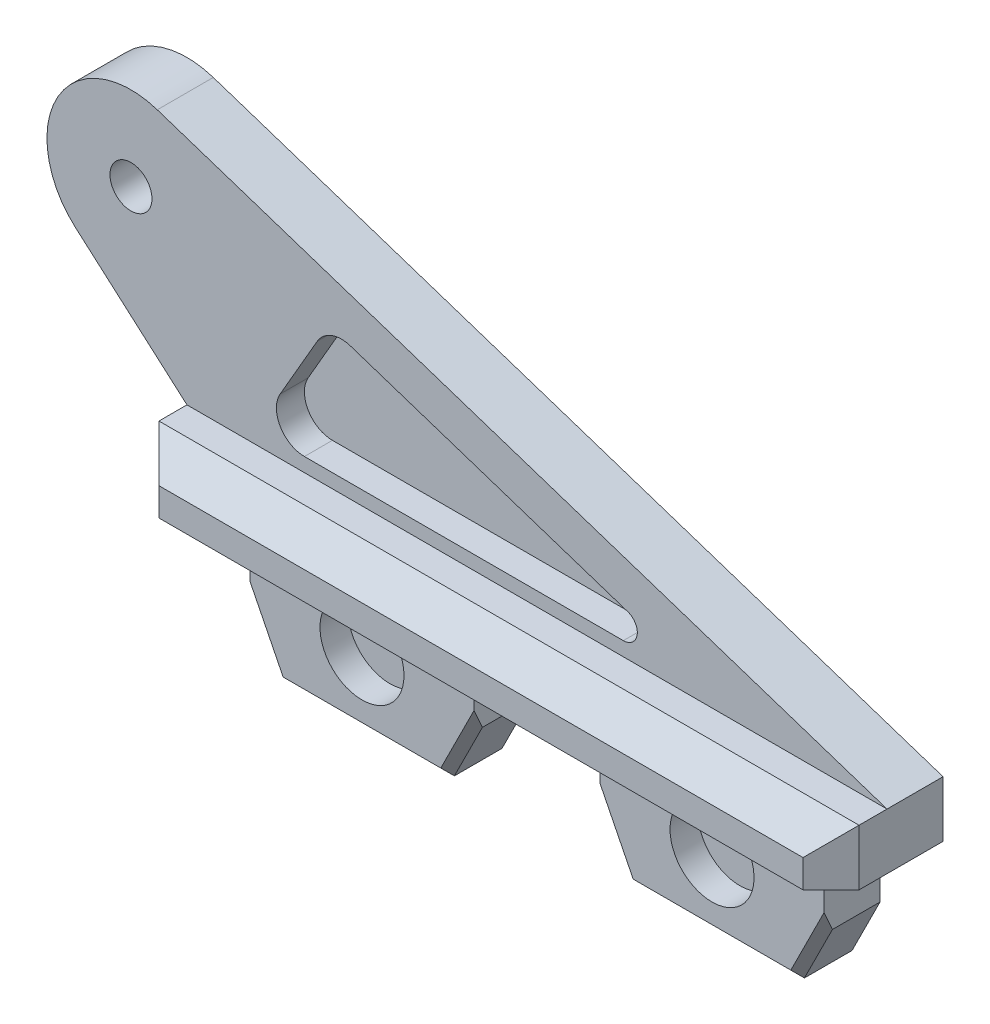
from build123d import *

# Parameters (mm, degrees)
SKIZZE1_R                       = 0.75
AUFSATZ_LINEAR_AUSTRAGEN1_DEPTH = 2
SKIZZE2_R                       = 1.5
SCHNITT_LINEAR_AUSTRAGEN1_DEPTH = 1
SKIZZE3_W                       = 25
SKIZZE3_H                       = 2
AUFSATZ_LINEAR_AUSTRAGEN2_DEPTH = 2
FASE1_SIZE                      = 1
SCHNITT_LINEAR_AUSTRAGEN2_DEPTH = 1
VERRUNDUNG1_R                   = 1
VERRUNDUNG2_R                   = 0.5
FASE2_SIZE                      = 0.3


with BuildPart() as part:
    # Skizze1 → Aufsatz-Linear austragen1 (new body)
    with BuildSketch(Plane.XY):
        with BuildLine():
            Line((9.25, -5), (3.25, -5))
            Line((3.25, -5), (2.25, -3))
            Line((2.25, -3), (2.25, 0))
            Line((2.25, 0), (0, 0))
            Line((0, 0), (0, 2))
            Line((0, 2), (-3.97861477, 5.490953701))
            ThreePointArc((-3.97861477, 5.490953701), (-4.604364731, 9.235021543), (-1.060351102, 10.595012138))
            Line((-1.060351102, 10.595012138), (25, 2))
            Line((25, 2), (25, 0))
            Line((25, 0), (22.75, 0))
            Line((22.75, 0), (22.75, -3))
            Line((22.75, -3), (21.75, -5))
            Line((21.75, -5), (15.75, -5))
            Line((15.75, -5), (14.75, -3))
            Line((14.75, -3), (14.75, 0))
            Line((14.75, 0), (10.25, 0))
            Line((10.25, 0), (10.25, -3))
            Line((10.25, -3), (9.25, -5))
        make_face()
        with Locations((-2, 7.745966692)):
            Circle(SKIZZE1_R, mode=Mode.SUBTRACT)
    extrude(amount=AUFSATZ_LINEAR_AUSTRAGEN1_DEPTH)

    # Skizze2 → Schnitt-Linear austragen1 (cut)
    with BuildSketch(Plane.XY.offset(2)):
        with Locations((6.25, -2.5)):
            Circle(SKIZZE2_R)
        with Locations(Location((18.75, -2.5, 0), (0, 0, 180))):
            Circle(SKIZZE2_R)
    extrude(amount=-SCHNITT_LINEAR_AUSTRAGEN1_DEPTH, mode=Mode.SUBTRACT)

    # Skizze3 → Aufsatz-Linear austragen2 (add)
    with BuildSketch(Plane.XY.offset(2)):
        with Locations((12.5, 1)):
            Rectangle(SKIZZE3_W, SKIZZE3_H)
    extrude(amount=AUFSATZ_LINEAR_AUSTRAGEN2_DEPTH)

    # Fase1
    fase1_edges = [part.edges().sort_by_distance(p)[0] for p in [
        (0, 1, 4),
        (25, 1, 4),
        (12.5, 2, 4),
    ]]
    chamfer(fase1_edges, length=FASE1_SIZE)

    # Skizze4 → Schnitt-Linear austragen2 (cut)
    with BuildSketch(Plane.XY.offset(2)):
        Polygon((5.059080896, 6.997274675), (18.694961237, 2.5), (2.462578152, 2.5), align=None)
    extrude(amount=-SCHNITT_LINEAR_AUSTRAGEN2_DEPTH, mode=Mode.SUBTRACT)

    # Verrundung1
    verrundung1_edges = [part.edges().sort_by_distance(p)[0] for p in [
        (2.462578152, 2.5, 1.5),
        (5.059080896, 6.997274675, 1.5),
    ]]
    fillet(verrundung1_edges, radius=VERRUNDUNG1_R)

    # Verrundung2
    verrundung2_edges = [part.edges().sort_by_distance(p)[0] for p in [
        (18.694961237, 2.5, 1.5),
    ]]
    fillet(verrundung2_edges, radius=VERRUNDUNG2_R)

    # Fase2
    fase2_edges = [part.edges().sort_by_distance(p)[0] for p in [
        (2.75, -4, 2),
        (6.25, -5, 2),
        (9.75, -4, 2),
        (15.25, -4, 2),
        (18.75, -5, 2),
        (22.25, -4, 2),
    ]]
    chamfer(fase2_edges, length=FASE2_SIZE)


solid = part.part
